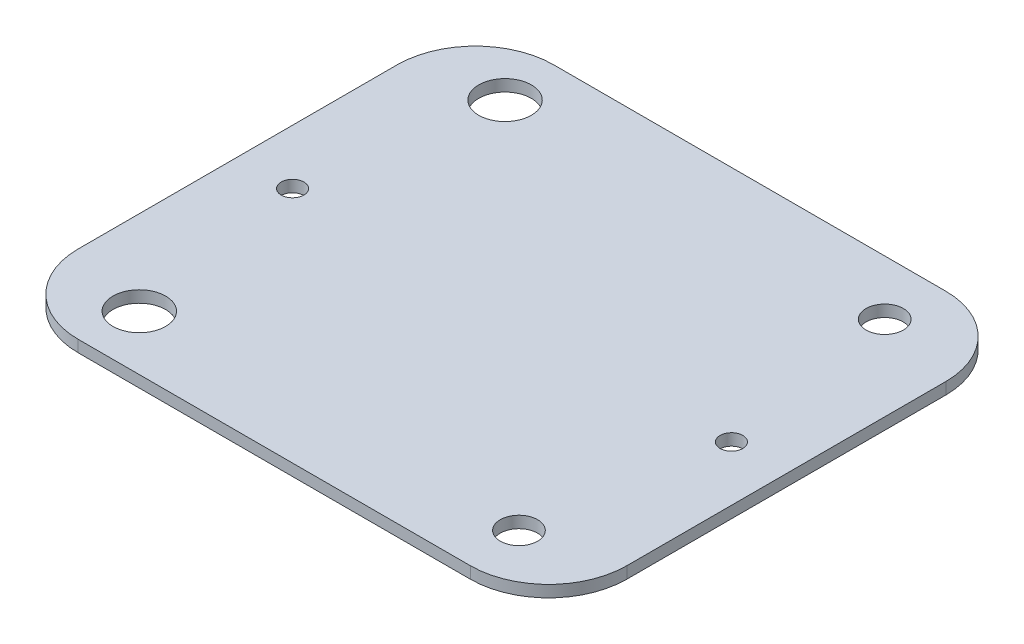
from build123d import *

# Parameters (mm, degrees)
BOSS_EXTRUDE1_DEPTH = 1.6
SKETCH2_R           = 2.55
SKETCH2_R_2         = 3.6
CUT_EXTRUDE1_DEPTH  = 1.6
SKETCH3_R           = 1.55
CUT_EXTRUDE2_DEPTH  = 1.6


with BuildPart() as part:
    # Sketch1 → Boss-Extrude1 (new body)
    with BuildSketch(Plane(origin=(0, 0, 0), x_dir=(1, 0, 0), z_dir=(0, 1, 0))):
        with BuildLine():
            Line((-26.8, 32.5), (26.8, 32.5))
            ThreePointArc((26.8, 32.5), (34.366042559, 29.366042559), (37.5, 21.8))
            Line((37.5, 21.8), (37.5, -21.8))
            ThreePointArc((37.5, -21.8), (34.366042559, -29.366042559), (26.8, -32.5))
            Line((26.8, -32.5), (-26.8, -32.5))
            ThreePointArc((-26.8, -32.5), (-34.366042559, -29.366042559), (-37.5, -21.8))
            Line((-37.5, -21.8), (-37.5, 21.8))
            ThreePointArc((-37.5, 21.8), (-34.366042559, 29.366042559), (-26.8, 32.5))
        make_face()
    extrude(amount=BOSS_EXTRUDE1_DEPTH)

    # Sketch2 → Cut-Extrude1 (cut)
    with BuildSketch(Plane(origin=(0, 1.6, 0), x_dir=(1, 0, 0), z_dir=(0, 1, 0))):
        with Locations(Location((25.95, 25, 0), (0, 0, 270))):
            Circle(SKETCH2_R)
        with Locations(Location((25.95, -25, 0), (0, 0, 270))):
            Circle(SKETCH2_R)
        with Locations(Location((-25.95, -25, 0), (0, 0, 270))):
            Circle(SKETCH2_R_2)
        with Locations(Location((-25.95, 25, 0), (0, 0, 270))):
            Circle(SKETCH2_R_2)
    extrude(amount=-CUT_EXTRUDE1_DEPTH, mode=Mode.SUBTRACT)

    # Sketch3 → Cut-Extrude2 (cut)
    with BuildSketch(Plane(origin=(0, 1.6, 0), x_dir=(1, 0, 0), z_dir=(0, 1, 0))):
        with Locations(Location((-30, 0, 0), (0, 0, 270))):
            Circle(SKETCH3_R)
        with Locations(Location((30, 0, 0), (0, 0, 270))):
            Circle(SKETCH3_R)
    extrude(amount=-CUT_EXTRUDE2_DEPTH, mode=Mode.SUBTRACT)


solid = part.part
